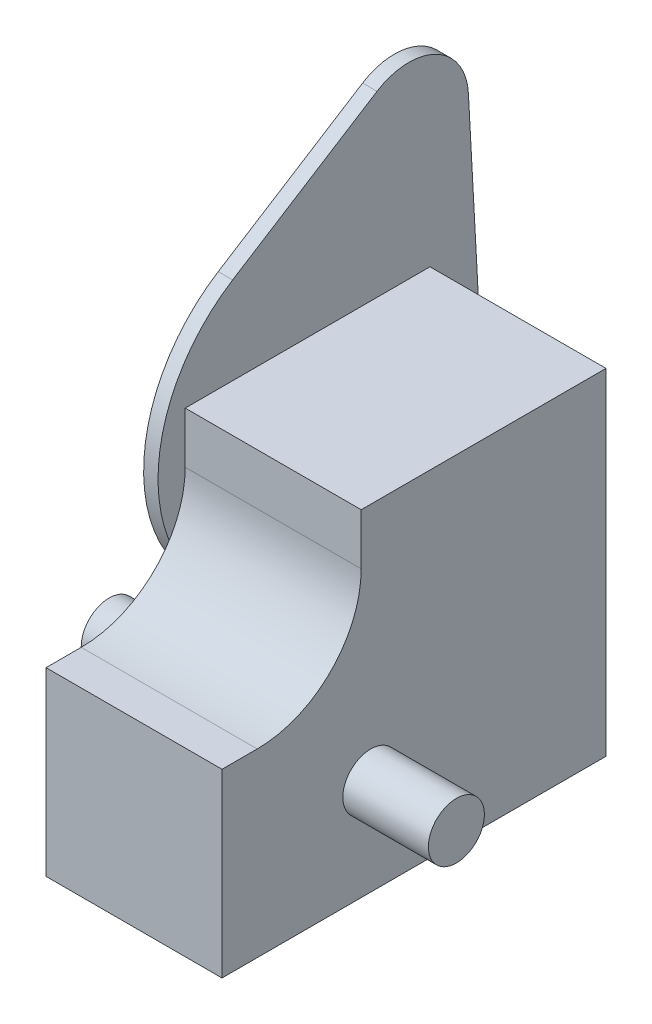
from build123d import *

# Parameters (mm, degrees)
EXTRUDE1_DEPTH = 13.97
SKETCH2_R      = 4.445
EXTRUDE2_DEPTH = 27.559
EXTRUDE3_DEPTH = 2.286


with BuildPart() as part:
    # Sketch1 → Extrude1 (new, symmetric)
    with BuildSketch(Plane(origin=(0, 0, 0), x_dir=(0, 0, -1), z_dir=(1, 0, 0))):
        with BuildLine():
            Line((-130.067375666, -21.122959685), (-69.107375666, -21.122959685))
            Line((-69.107375666, -21.122959685), (-69.107375666, 32.217040315))
            Line((-69.107375666, 32.217040315), (-107.969375666, 32.217040315))
            Line((-107.969375666, 32.217040315), (-107.969375666, 24.089040315))
            ThreePointArc((-107.969375666, 24.089040315), (-112.805042709, 12.414707357), (-124.479375666, 7.579040315))
            Line((-124.479375666, 7.579040315), (-130.067375666, 7.579040315))
            Line((-130.067375666, 7.579040315), (-130.067375666, -21.122959685))
        make_face()
    extrude(amount=EXTRUDE1_DEPTH, both=True)


with BuildPart() as body_2:
    # Sketch2 → Extrude2 (new, symmetric)
    with BuildSketch(Plane(origin=(0, 0, 0), x_dir=(0, 0, -1), z_dir=(1, 0, 0))):
        with Locations(Location((-106.445375666, -5.882959685, 0), (0, 0, 180))):
            Circle(SKETCH2_R)
    extrude(amount=EXTRUDE2_DEPTH, both=True)


with BuildPart() as body_3:
    # Sketch3 → Extrude3 (new body)
    with BuildSketch(Plane.ZY.offset(13.97)):
        with BuildLine():
            Line((63.010638923, 53.055826512), (61.525522421, 25.988586197))
            ThreePointArc((61.525522421, 25.988586197), (98.53745862, 2.026360946), (100.44400064, 46.076749794))
            Line((100.44400064, 46.076749794), (77.519948018, 60.544952195))
            ThreePointArc((77.519948018, 60.544952195), (68.122563195, 60.951679798), (63.010638923, 53.055826512))
        make_face()
    extrude(amount=EXTRUDE3_DEPTH)


solid = Compound([part.part, body_2.part, body_3.part])
